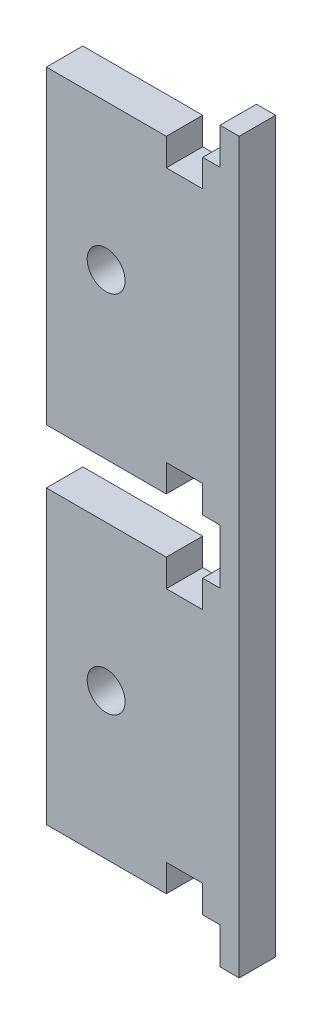
from build123d import *

# Parameters (mm, degrees)
SKETCH2_W               = 40.64
SKETCH2_H               = 127
BOSS_EXTRUDE1_DEPTH     = 6.35
M6_CLEARANCE_HOLE1_D    = 6.6
CUT_EXTRUDE1_DEPTH      = 134.495063954
CUT_EXTRUDE1_DEPTH_BACK = 134.495063954
SKETCH5_W               = 7.0505
SKETCH5_H               = 127
SKETCH6_W               = 27.8745
SKETCH6_H               = 3.175
CUT_EXTRUDE2_DEPTH      = 134.495063954
SKETCH7_W               = 6.35
SKETCH7_H               = 4.7625
CUT_EXTRUDE3_DEPTH      = 134.495063954


with BuildPart() as part:
    # Sketch2 → Boss-Extrude1 (new body)
    with BuildSketch(Plane.XY):
        with Locations((20.32, 63.5)):
            Rectangle(SKETCH2_W, SKETCH2_H)
    extrude(amount=BOSS_EXTRUDE1_DEPTH)

    # M6 Clearance Hole1 (through all)
    with Locations(Plane.XY.offset(6.35)):
        with Locations((17.4625, 31.75), (17.4625, 95.25)):
            Hole(M6_CLEARANCE_HOLE1_D / 2)

    # Sketch5 → Cut-Extrude1 (cut, two sides: drawn at the far end of the back side and taken through both)
    with BuildSketch(Plane.XY.offset(6.35).offset(-CUT_EXTRUDE1_DEPTH_BACK)):
        with Locations((3.52525, 63.5)):
            Rectangle(SKETCH5_W, SKETCH5_H)
    extrude(amount=CUT_EXTRUDE1_DEPTH + CUT_EXTRUDE1_DEPTH_BACK, mode=Mode.SUBTRACT)

    # Sketch6 → Cut-Extrude2 (cut, through all)
    with BuildSketch(Plane.XY.offset(6.35)):
        Polygon((7.0505, 123.825), (7.0505, 120.65), (37.30625, 120.65), (37.30625, 127), (34.925, 127), (34.925, 123.825), align=None)
        with Locations((20.98775, 125.4125)):
            Rectangle(SKETCH6_W, SKETCH6_H)
        Polygon((37.30625, 66.675), (7.0505, 66.675), (7.0505, 63.5), (34.925, 63.5), (34.925, 60.325), (7.0505, 60.325), (7.0505, 57.15), (37.30625, 57.15), align=None)
        with Locations((20.98775, 61.9125)):
            Rectangle(SKETCH6_W, SKETCH6_H)
        Polygon((37.30625, 0), (37.30625, 6.35), (7.0505, 6.35), (7.0505, 3.175), (34.925, 3.175), (34.925, 0), align=None)
        with Locations((20.98775, 1.5875)):
            Rectangle(SKETCH6_W, SKETCH6_H)
    extrude(amount=-CUT_EXTRUDE2_DEPTH, mode=Mode.SUBTRACT)

    # Sketch7 → Cut-Extrude3 (cut, through all)
    with BuildSketch(Plane.XY.offset(6.35)):
        with Locations((31.115, 118.26875)):
            Rectangle(SKETCH7_W, SKETCH7_H)
        with Locations((31.115, 69.05625)):
            Rectangle(SKETCH7_W, SKETCH7_H)
        with Locations((31.115, 54.76875)):
            Rectangle(SKETCH7_W, SKETCH7_H)
        with Locations((31.115, 8.73125)):
            Rectangle(SKETCH7_W, SKETCH7_H)
    extrude(amount=-CUT_EXTRUDE3_DEPTH, mode=Mode.SUBTRACT)


solid = part.part
